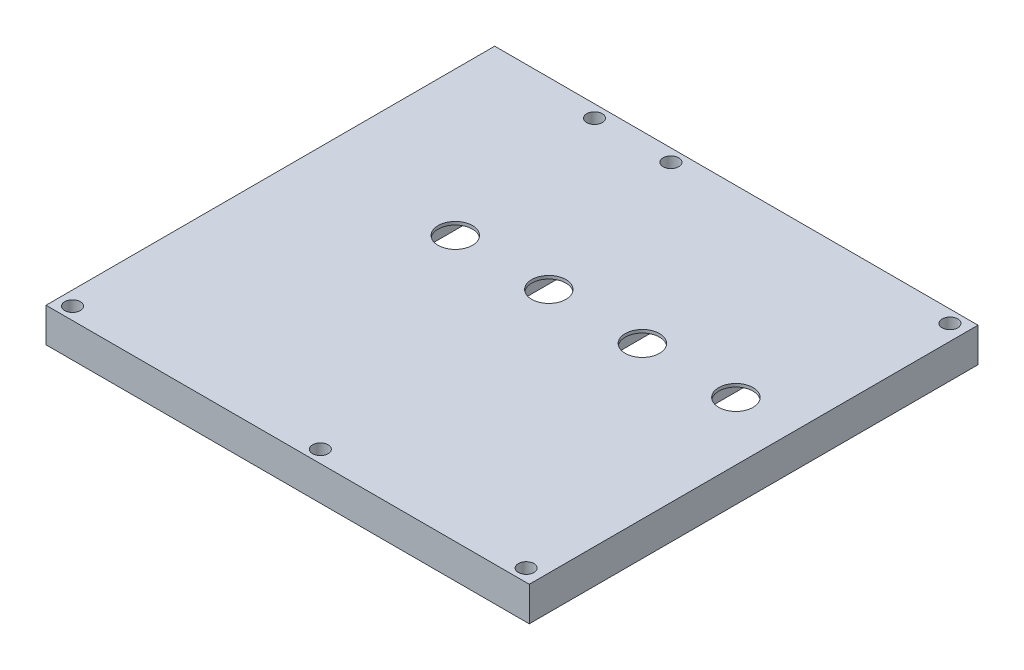
from build123d import *

# Parameters (mm, degrees)
SKETCH1_W           = 155
SKETCH1_H           = 143.921385084
BOSS_EXTRUDE1_DEPTH = 11
SKETCH2_W           = 57
SKETCH2_H           = 20
CUT_EXTRUDE1_DEPTH  = 10
SKETCH3_W           = 25
SKETCH3_H           = 65.9
CUT_EXTRUDE2_DEPTH  = 10
LPATTERN1_COUNT     = 4
LPATTERN1_PITCH     = 30
CUT_EXTRUDE11_DEPTH = 5
LPATTERN3_COUNT     = 8
LPATTERN3_PITCH     = 15.5
SKETCH27_W          = 2
SKETCH27_H          = 24.887973174
CUT_EXTRUDE14_DEPTH = 2
LPATTERN4_COUNT     = 8
LPATTERN4_PITCH     = 15.5
SKETCH28_R          = 1.5
CUT_EXTRUDE15_DEPTH = 6
SKETCH32_W          = 30
SKETCH32_H          = 35
CUT_EXTRUDE18_DEPTH = 10
CUT_EXTRUDE21_DEPTH = 9
SKETCH36_R          = 1.5
CUT_EXTRUDE23_DEPTH = 3
SKETCH37_R          = 2.5
CUT_EXTRUDE24_DEPTH = 5
SKETCH38_R          = 3
CUT_EXTRUDE25_DEPTH = 6
SKETCH4_R           = 5.5
CUT_EXTRUDE28_DEPTH = 11
LPATTERN6_COUNT     = 4
LPATTERN6_PITCH     = 30
LPATTERN8_COUNT     = 2
LPATTERN8_PITCH     = 60
CUT_EXTRUDE29_START = 6
SKETCH37_2_R        = 2.5
CUT_EXTRUDE29_DEPTH = 5
SKETCH39_W          = 5
SKETCH39_H          = 11
CUT_EXTRUDE30_DEPTH = 3
LPATTERN9_COUNT     = 3
LPATTERN9_PITCH     = 30
SKETCH40_W          = 5
SKETCH40_H          = 9
CUT_EXTRUDE31_DEPTH = 2
LPATTERN10_COUNT    = 4
LPATTERN10_PITCH    = 30


with BuildPart() as part:
    # Sketch1 → Boss-Extrude1 (new body)
    with BuildSketch(Plane(origin=(0, 0, 0), x_dir=(1, 0, 0), z_dir=(0, 1, 0))):
        with Locations((221.458624358, -71.960692542)):
            Rectangle(SKETCH1_W, SKETCH1_H)
    extrude(amount=BOSS_EXTRUDE1_DEPTH)

    # Sketch2 → Cut-Extrude1 (cut)
    with BuildSketch(Plane(origin=(0, 0, 0), x_dir=(1, 0, 0), z_dir=(0, 1, 0))):
        with Locations((244.958624358, -10)):
            Rectangle(SKETCH2_W, SKETCH2_H)
    extrude(amount=CUT_EXTRUDE1_DEPTH, mode=Mode.SUBTRACT)

    # Sketch3 → Cut-Extrude2 (cut)
    with BuildSketch(Plane(origin=(0, 0, 0), x_dir=(1, 0, 0), z_dir=(0, 1, 0))):
        with Locations((280.208624358, -52.95)):
            Rectangle(SKETCH3_W, SKETCH3_H)
    cut_extrude2 = extrude(amount=CUT_EXTRUDE2_DEPTH, mode=Mode.SUBTRACT)

    # LPattern1: Cut-Extrude2 ×4
    with Locations(*[(-i * LPATTERN1_PITCH, 0, 0) for i in range(1, LPATTERN1_COUNT)]):
        add(cut_extrude2, mode=Mode.SUBTRACT)

    # Sketch25 → Cut-Extrude11 (cut)
    with BuildSketch(Plane(origin=(0, 0, 0), x_dir=(1, 0, 0), z_dir=(0, 1, 0))):
        with BuildLine():
            Line((292.458624358, -92.9), (296.958624358, -98.537973174))
            Line((296.958624358, -98.537973174), (296.958624358, -108.787973174))
            ThreePointArc((296.958624358, -108.787973174), (290.208624358, -110.636601358), (283.458624358, -108.787973174))
            Line((283.458624358, -108.787973174), (283.458624358, -98.537973174))
            Line((283.458624358, -98.537973174), (287.958624358, -92.9))
            Line((287.958624358, -92.9), (287.958624358, -85.9))
            Line((287.958624358, -85.9), (292.458624358, -85.9))
            Line((292.458624358, -85.9), (292.458624358, -92.9))
        make_face()
        with BuildLine():
            Line((284.708624358, -117.787973174), (289.208624358, -123.425946348))
            Line((289.208624358, -123.425946348), (289.208624358, -133.675946348))
            ThreePointArc((289.208624358, -133.675946348), (282.458624358, -135.524574532), (275.708624358, -133.675946348))
            Line((275.708624358, -133.675946348), (275.708624358, -123.425946348))
            Line((275.708624358, -123.425946348), (280.208624358, -117.787973174))
            Line((280.208624358, -117.787973174), (280.208624358, -110.787973174))
            Line((280.208624358, -110.787973174), (284.708624358, -110.787973174))
            Line((284.708624358, -110.787973174), (284.708624358, -117.787973174))
        make_face()
    cut_extrude11 = extrude(amount=CUT_EXTRUDE11_DEPTH, mode=Mode.SUBTRACT)

    # LPattern3: Cut-Extrude11 ×8
    with Locations(*[(-i * LPATTERN3_PITCH, 0, 0) for i in range(1, LPATTERN3_COUNT)]):
        add(cut_extrude11, mode=Mode.SUBTRACT)

    # Sketch27 → Cut-Extrude14 (cut)
    with BuildSketch(Plane(origin=(0, 0, 0), x_dir=(1, 0, 0), z_dir=(0, 1, 0))):
        with Locations((282.458624358, -98.343986587)):
            Rectangle(SKETCH27_W, SKETCH27_H)
    cut_extrude14 = extrude(amount=CUT_EXTRUDE14_DEPTH, mode=Mode.SUBTRACT)

    # LPattern4: Cut-Extrude14 ×8
    with Locations(*[(-i * LPATTERN4_PITCH, 0, 0) for i in range(1, LPATTERN4_COUNT)]):
        add(cut_extrude14, mode=Mode.SUBTRACT)

    # Sketch28 → Cut-Extrude15 (cut)
    with BuildSketch(Plane(origin=(0, 0, 0), x_dir=(1, 0, 0), z_dir=(0, 1, 0))):
        with Locations(Location((295.208624358, -35, 0), (0, 0, 270))):
            Circle(SKETCH28_R)
        with Locations(Location((295.208624358, -65, 0), (0, 0, 270))):
            Circle(SKETCH28_R)
        with Locations(Location((265.208624358, -65, 0), (0, 0, 270))):
            Circle(SKETCH28_R)
        with Locations(Location((265.208624358, -35, 0), (0, 0, 270))):
            Circle(SKETCH28_R)
        with Locations(Location((265.208624358, -42, 0), (0, 0, 270))):
            Circle(SKETCH28_R)
        with Locations(Location((265.208624358, -72, 0), (0, 0, 270))):
            Circle(SKETCH28_R)
        with Locations(Location((235.208624358, -42, 0), (0, 0, 270))):
            Circle(SKETCH28_R)
        with Locations(Location((235.208624358, -72, 0), (0, 0, 270))):
            Circle(SKETCH28_R)
    cut_extrude15 = extrude(amount=CUT_EXTRUDE15_DEPTH, mode=Mode.SUBTRACT)

    # Sketch32 → Cut-Extrude18 (cut)
    with BuildSketch(Plane(origin=(0, 0, 0), x_dir=(1, 0, 0), z_dir=(0, 1, 0))):
        with Locations((158.958624358, -17.5)):
            Rectangle(SKETCH32_W, SKETCH32_H)
    extrude(amount=CUT_EXTRUDE18_DEPTH, mode=Mode.SUBTRACT)

    # Sketch35 → Cut-Extrude21 (cut)
    with BuildSketch(Plane(origin=(0, 0, 0), x_dir=(1, 0, 0), z_dir=(0, 1, 0))):
        Polygon((173.958624358, -35), (148.958624358, -35), (148.958624358, -52.942375235), (148.958624358, -130.744291736), (164.958624358, -130.744291736), (164.958624358, -52.942375235), align=None)
    extrude(amount=CUT_EXTRUDE21_DEPTH, mode=Mode.SUBTRACT)

    # Sketch36 → Cut-Extrude23 (cut)
    with BuildSketch(Plane(origin=(0, 0, 0), x_dir=(1, 0, 0), z_dir=(0, 1, 0))):
        with Locations(Location((167.958624358, -93.537973174, 0), (0, 0, 270))):
            Circle(SKETCH36_R)
        with Locations(Location((146.458624358, -93.537973174, 0), (0, 0, 270))):
            Circle(SKETCH36_R)
        with Locations(Location((146.458624358, -55.370036538, 0), (0, 0, 270))):
            Circle(SKETCH36_R)
        with Locations(Location((167.958624358, -55.370036538, 0), (0, 0, 270))):
            Circle(SKETCH36_R)
    extrude(amount=CUT_EXTRUDE23_DEPTH, mode=Mode.SUBTRACT)

    # Sketch37 → Cut-Extrude24 (cut)
    with BuildSketch(Plane(origin=(0, 0, 0), x_dir=(1, 0, 0), z_dir=(0, 1, 0))):
        with Locations(Location((293.958624358, -139.921385084, 0), (0, 0, 270))):
            Circle(SKETCH37_R)
        with Locations(Location((148.458624358, -139.921385084, 0), (0, 0, 270))):
            Circle(SKETCH37_R)
        with Locations(Location((227.958624358, -139.921385084, 0), (0, 0, 270))):
            Circle(SKETCH37_R)
        with Locations(Location((293.958624358, -4, 0), (0, 0, 270))):
            Circle(SKETCH37_R)
        with Locations(Location((204.458624358, -4, 0), (0, 0, 270))):
            Circle(SKETCH37_R)
        with Locations(Location((179.958624358, -4, 0), (0, 0, 270))):
            Circle(SKETCH37_R)
    extrude(amount=CUT_EXTRUDE24_DEPTH, mode=Mode.SUBTRACT)

    # Sketch38 → Cut-Extrude25 (cut)
    with BuildSketch(Plane.XY):
        with Locations((285.958624358, 5.860688918)):
            Circle(SKETCH38_R)
        with Locations((210.71384059, 5.860688918)):
            Circle(SKETCH38_R)
        with Locations((186.94768624, 5.860688918)):
            Circle(SKETCH38_R)
    extrude(amount=CUT_EXTRUDE25_DEPTH, mode=Mode.SUBTRACT)

    # Sketch4 → Cut-Extrude28 (cut)
    with BuildSketch(Plane(origin=(0, 0, 0), x_dir=(1, 0, 0), z_dir=(0, 1, 0))):
        with Locations(Location((280.208624358, -58.9, 0), (0, 0, 90))):
            Circle(SKETCH4_R)
    cut_extrude28 = extrude(amount=CUT_EXTRUDE28_DEPTH, mode=Mode.SUBTRACT)

    # LPattern6: Cut-Extrude28 ×4
    with Locations(*[(-i * LPATTERN6_PITCH, 0, 0) for i in range(1, LPATTERN6_COUNT)]):
        add(cut_extrude28, mode=Mode.SUBTRACT)

    # LPattern8: Cut-Extrude15 ×2
    with Locations(*[(-i * LPATTERN8_PITCH, 0, 0) for i in range(1, LPATTERN8_COUNT)]):
        add(cut_extrude15, mode=Mode.SUBTRACT)

    # Sketch37<2> → Cut-Extrude29 (cut)
    with BuildSketch(Plane(origin=(0, 0, 0), x_dir=(1, 0, 0), z_dir=(0, 1, 0)).offset(CUT_EXTRUDE29_START)):
        with Locations(Location((293.958624358, -139.921385084, 0), (0, 0, 270))):
            Circle(SKETCH37_2_R)
        with Locations(Location((148.458624358, -139.921385084, 0), (0, 0, 270))):
            Circle(SKETCH37_2_R)
        with Locations(Location((227.958624358, -139.921385084, 0), (0, 0, 270))):
            Circle(SKETCH37_2_R)
        with Locations(Location((293.958624358, -4, 0), (0, 0, 270))):
            Circle(SKETCH37_2_R)
        with Locations(Location((204.458624358, -4, 0), (0, 0, 270))):
            Circle(SKETCH37_2_R)
        with Locations(Location((179.958624358, -4, 0), (0, 0, 270))):
            Circle(SKETCH37_2_R)
    extrude(amount=CUT_EXTRUDE29_DEPTH, mode=Mode.SUBTRACT)

    # Sketch39 → Cut-Extrude30 (cut)
    with BuildSketch(Plane(origin=(0, 0, 0), x_dir=(1, 0, 0), z_dir=(0, 1, 0))):
        with Locations((265.208624358, -25.5)):
            Rectangle(SKETCH39_W, SKETCH39_H)
    cut_extrude30 = extrude(amount=CUT_EXTRUDE30_DEPTH, mode=Mode.SUBTRACT)

    # LPattern9: Cut-Extrude30 ×3
    with Locations(*[(-i * LPATTERN9_PITCH, 0, 0) for i in range(1, LPATTERN9_COUNT)]):
        add(cut_extrude30, mode=Mode.SUBTRACT)

    # Sketch40 → Cut-Extrude31 (cut)
    with BuildSketch(Plane(origin=(0, 0, 0), x_dir=(1, 0, 0), z_dir=(0, 1, 0))):
        with Locations((265.208624358, -81.4)):
            Rectangle(SKETCH40_W, SKETCH40_H)
    cut_extrude31 = extrude(amount=CUT_EXTRUDE31_DEPTH, mode=Mode.SUBTRACT)

    # LPattern10: Cut-Extrude31 ×4
    with Locations(*[(-i * LPATTERN10_PITCH, 0, 0) for i in range(1, LPATTERN10_COUNT)]):
        add(cut_extrude31, mode=Mode.SUBTRACT)


solid = part.part
